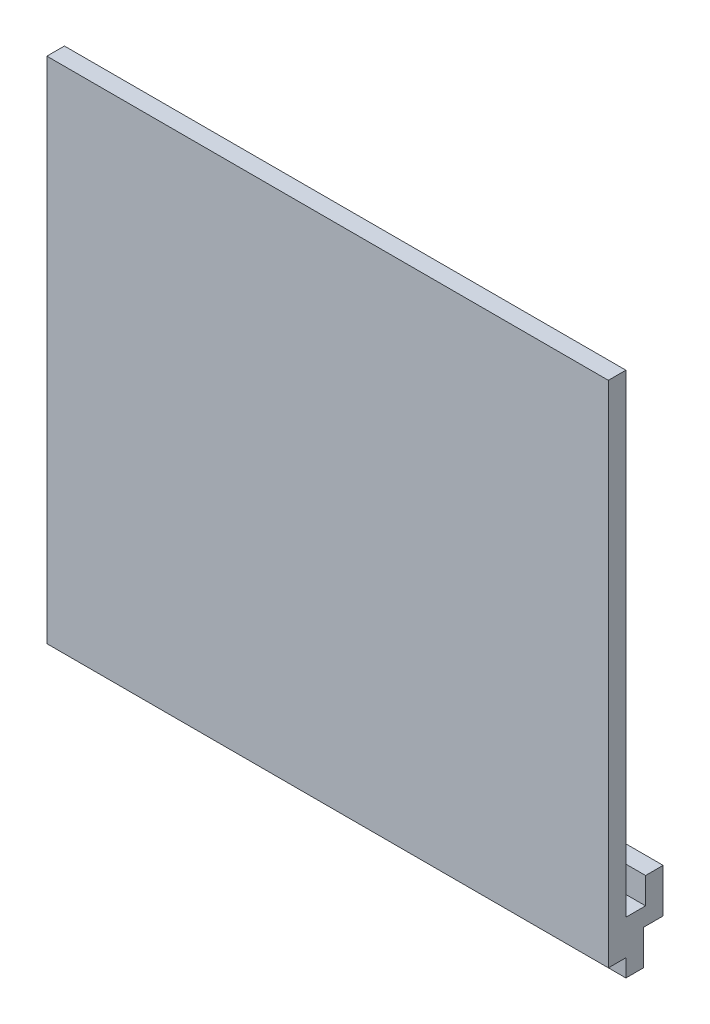
from build123d import *

# Parameters (mm, degrees)
BOSS_EXTRUDE1_DEPTH = 406.4
SKETCH3_W           = 12.7
SKETCH3_H           = 12.7
BOSS_EXTRUDE2_DEPTH = 406.4
SKETCH4_W           = 12.7
SKETCH4_H           = 25.4
BOSS_EXTRUDE3_DEPTH = 406.4


with BuildPart() as part:
    # Sketch2 → Boss-Extrude1 (new body)
    with BuildSketch(Plane(origin=(0, 0, 0), x_dir=(0, 0, -1), z_dir=(1, 0, 0))):
        Polygon((0, 0), (39.639393939, 0), (39.639393939, 31.75), (26.939393939, 31.75), (26.939393939, 12.7), (12.7, 12.7), (12.7, 355.6), (0, 355.6), align=None)
    extrude(amount=BOSS_EXTRUDE1_DEPTH)

    # Sketch3 → Boss-Extrude2 (add)
    with BuildSketch(Plane(origin=(406.4, 0, 0), x_dir=(0, 0, -1), z_dir=(1, 0, 0))):
        with Locations((6.35, -6.35)):
            Rectangle(SKETCH3_W, SKETCH3_H)
    extrude(amount=-BOSS_EXTRUDE2_DEPTH)

    # Sketch4 → Boss-Extrude3 (add)
    with BuildSketch(Plane(origin=(406.4, 0, 0), x_dir=(0, 0, -1), z_dir=(1, 0, 0))):
        with Locations((19.05, -12.7)):
            Rectangle(SKETCH4_W, SKETCH4_H)
    extrude(amount=-BOSS_EXTRUDE3_DEPTH)


solid = part.part
